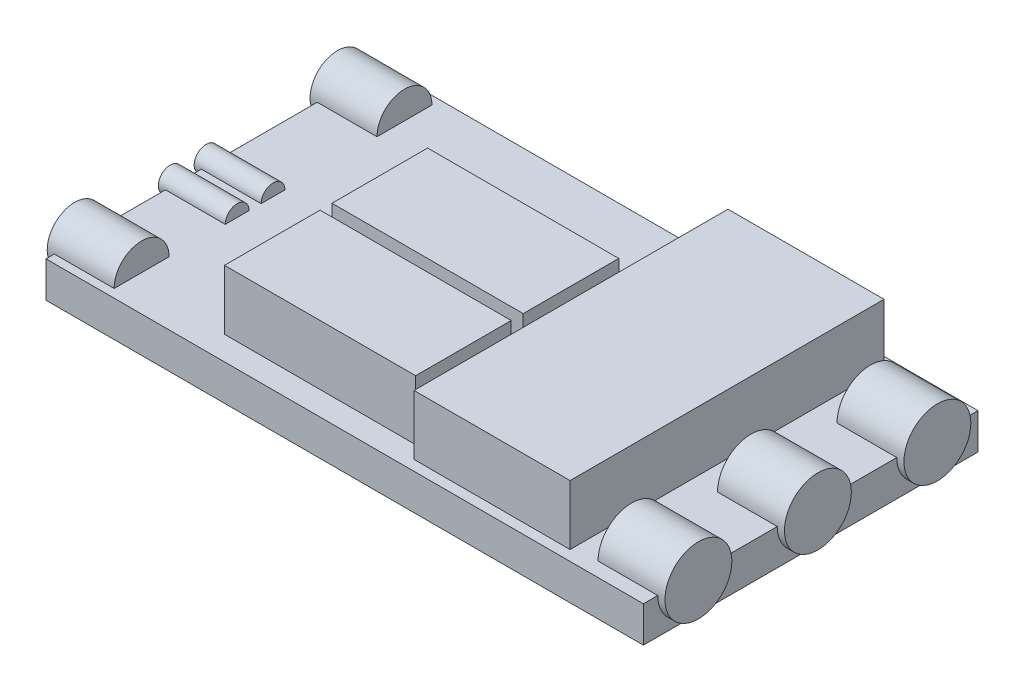
from build123d import *

# Parameters (mm, degrees)
SKIZZE1_W            = 25
SKIZZE1_H            = 14
PLATINE_DEPTH        = 1.5
SKIZZE2_W            = 6.530722005
SKIZZE2_H            = 13.138578522
MOSFETS_DEPTH        = 2.5
SKIZZE4_W            = 8
SKIZZE4_H            = 4
WEITERE_ICS_DEPTH    = 2.5
LOT_MOTOR_DEPTH      = 0.3
LOT_MOTOR_DEPTH_BACK = 2.5
SKIZZE5_R            = 1.4
LOT_PDB_DEPTH        = 0.3
LOT_PDB_DEPTH_BACK   = 2.5
SKIZZE6_R            = 1.15
LOT_FC_DEPTH         = 0.3
LOT_FC_DEPTH_BACK    = 2.5
SKIZZE7_R            = 0.5


with BuildPart() as part:
    # Skizze1 → Platine (new body)
    with BuildSketch(Plane(origin=(0, 0, 0), x_dir=(1, 0, 0), z_dir=(0, 1, 0))):
        Rectangle(SKIZZE1_W, SKIZZE1_H)
    extrude(amount=PLATINE_DEPTH)

    # Skizze2 → MOSFETs (add)
    with BuildSketch(Plane(origin=(0, 1.5, 0), x_dir=(1, 0, 0), z_dir=(0, 1, 0))):
        with Locations((5.733665382, 0)):
            Rectangle(SKIZZE2_W, SKIZZE2_H)
    extrude(amount=MOSFETS_DEPTH)

    # Skizze4 → Weitere_ICs (add)
    with BuildSketch(Plane(origin=(0, 1.5, 0), x_dir=(1, 0, 0), z_dir=(0, 1, 0))):
        with Locations((-2.03169562, -4)):
            Rectangle(SKIZZE4_W, SKIZZE4_H)
        with Locations((-2.03169562, 0.5)):
            Rectangle(SKIZZE4_W, SKIZZE4_H)
    extrude(amount=WEITERE_ICS_DEPTH)

    # Skizze5 → Lot_Motor (add, two sides: drawn at the far end of the back side and taken through both)
    with BuildSketch(Plane(origin=(12.5, 0, 0), x_dir=(0, 0, -1), z_dir=(1, 0, 0)).offset(-LOT_MOTOR_DEPTH_BACK)):
        with Locations((-5, 1.5)):
            Circle(SKIZZE5_R)
        with Locations((0, 1.5)):
            Circle(SKIZZE5_R)
        with Locations((5, 1.5)):
            Circle(SKIZZE5_R)
    extrude(amount=LOT_MOTOR_DEPTH + LOT_MOTOR_DEPTH_BACK)

    # Skizze6 → Lot_PDB (add, two sides: drawn at the far end of the back side and taken through both)
    with BuildSketch(Plane.ZY.offset(12.5).offset(-LOT_PDB_DEPTH_BACK)):
        with Locations((-5.5, 1.5)):
            Circle(SKIZZE6_R)
        with Locations((5.5, 1.5)):
            Circle(SKIZZE6_R)
    extrude(amount=LOT_PDB_DEPTH + LOT_PDB_DEPTH_BACK)

    # Skizze7 → Lot_FC (add, two sides: drawn at the far end of the back side and taken through both)
    with BuildSketch(Plane.ZY.offset(12.5).offset(-LOT_FC_DEPTH_BACK)):
        with Locations((1.5, 1.5)):
            Circle(SKIZZE7_R)
        with Locations((0, 1.5)):
            Circle(SKIZZE7_R)
    extrude(amount=LOT_FC_DEPTH + LOT_FC_DEPTH_BACK)


solid = part.part
